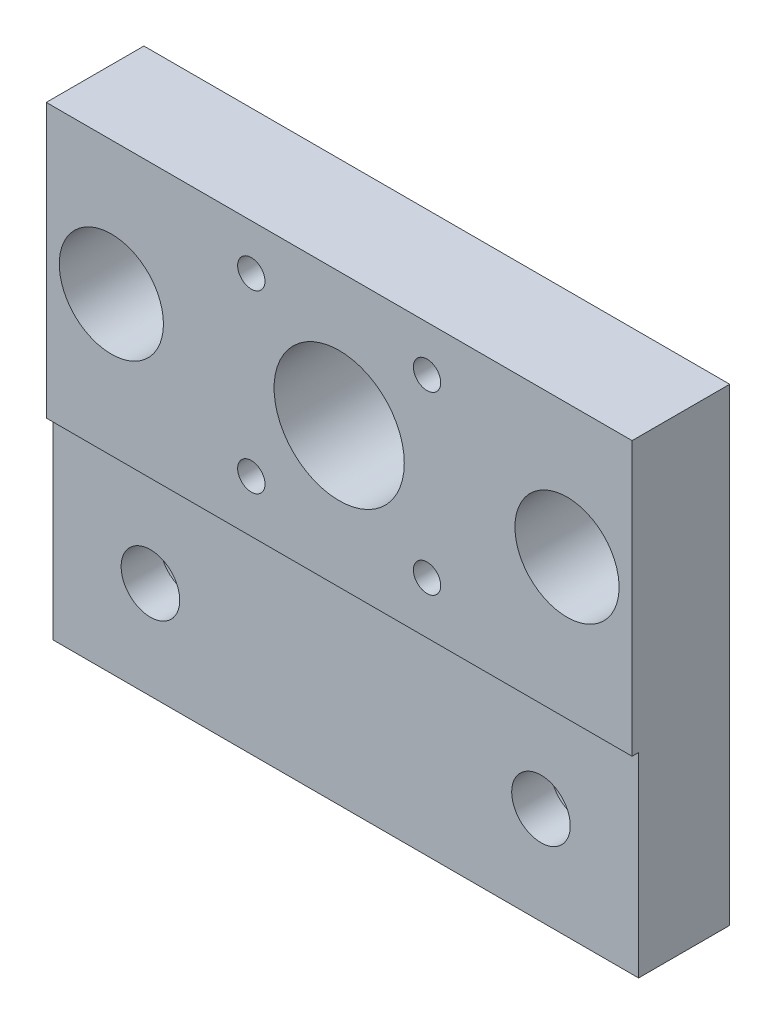
from build123d import *

# Parameters (mm, degrees)
SKETCH1_W                      = 90
SKETCH1_H                      = 72
BOSS_EXTRUDE1_DEPTH            = 15
SKETCH2_W                      = 90
SKETCH2_H                      = 30
CUT_EXTRUDE1_DEPTH             = 1
SKETCH4_R                      = 10
SKETCH4_R_2                    = 8
CUT_EXTRUDE3_DEPTH             = 60.548299724
CBORE_FOR_M8_SHCS1_D           = 9
CBORE_FOR_M8_SHCS1_DEPTH       = 15
CBORE_FOR_M8_SHCS1_CBORE_D     = 15
CBORE_FOR_M8_SHCS1_CBORE_DEPTH = 8
CBORE_FOR_M8_SHCS1_TIP         = 2.703872786
M5X0_8_TAPPED_HOLE1_D          = 4.2


with BuildPart() as part:
    # Sketch1 → Boss-Extrude1 (new body)
    with BuildSketch(Plane.XY):
        Rectangle(SKETCH1_W, SKETCH1_H)
    extrude(amount=BOSS_EXTRUDE1_DEPTH)

    # Sketch2 → Cut-Extrude1 (cut)
    with BuildSketch(Plane.XY.offset(15)):
        with Locations((0, -21)):
            Rectangle(SKETCH2_W, SKETCH2_H)
    extrude(amount=-CUT_EXTRUDE1_DEPTH, mode=Mode.SUBTRACT)

    # Sketch4 → Cut-Extrude3 (cut, through all)
    with BuildSketch(Plane.XY.offset(15)):
        with Locations((0, 15.5)):
            Circle(SKETCH4_R)
        with Locations((-35, 15.5)):
            Circle(SKETCH4_R_2)
        with Locations(Location((35, 15.5, 0), (0, 0, 180))):
            Circle(SKETCH4_R_2)
    extrude(amount=-CUT_EXTRUDE3_DEPTH, mode=Mode.SUBTRACT)

    # CBORE for M8 SHCS1
    with Locations(Plane(origin=(0, 0, 0), x_dir=(-1, 0, 0), z_dir=(0, 0, -1))):
        with Locations((30, -21), (-30, -21)):
            CounterBoreHole(CBORE_FOR_M8_SHCS1_D / 2, CBORE_FOR_M8_SHCS1_CBORE_D / 2, CBORE_FOR_M8_SHCS1_CBORE_DEPTH, depth=CBORE_FOR_M8_SHCS1_DEPTH)
            with Locations((0, 0, -(CBORE_FOR_M8_SHCS1_DEPTH + CBORE_FOR_M8_SHCS1_TIP / 2))):  # 118° drill point
                Cone(0, CBORE_FOR_M8_SHCS1_D / 2, CBORE_FOR_M8_SHCS1_TIP, mode=Mode.SUBTRACT)

    # M5x0.8 Tapped Hole1 (through all)
    with Locations(Plane(origin=(0, 0, 0), x_dir=(-1, 0, 0), z_dir=(0, 0, -1))):
        with Locations((13.5, 2), (13.5, 29), (-13.5, 29), (-13.5, 2)):
            Hole(M5X0_8_TAPPED_HOLE1_D / 2)


solid = part.part
